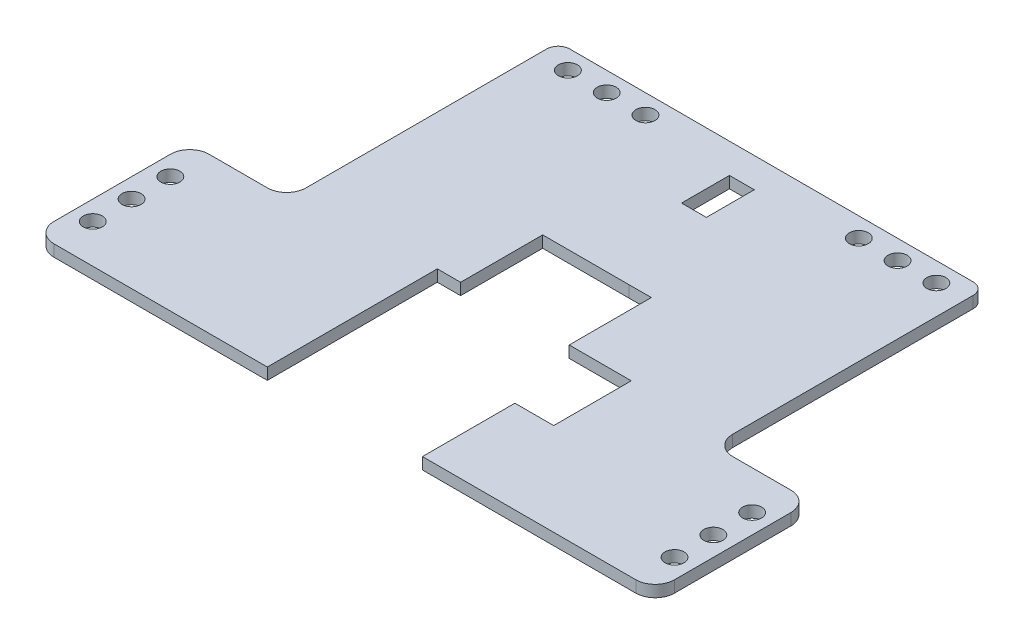
from build123d import *

# Parameters (mm, degrees)
SKETCH2_W           = 6.4
SKETCH2_H           = 12.35
SKETCH2_R           = 2.45
BOSS_EXTRUDE1_DEPTH = 3


with BuildPart() as part:
    # Sketch2 → Boss-Extrude1 (new body)
    with BuildSketch(Plane(origin=(0, 40, 0), x_dir=(1, 0, 0), z_dir=(0, 1, 0))):
        with BuildLine():
            Line((30, -16.164928148), (20, -16.164928148))
            Line((20, -16.164928148), (20, -40))
            Line((20, -40), (75, -40))
            ThreePointArc((75, -40), (78.535533906, -38.535533906), (80, -35))
            Line((80, -35), (80, -5))
            ThreePointArc((80, -5), (78.535533906, -1.464466094), (75, 0))
            Line((75, 0), (60, 0))
            ThreePointArc((60, 0), (56.464466094, 1.464466094), (55, 5))
            Line((55, 5), (55, 67))
            ThreePointArc((55, 67), (54.121320344, 69.121320344), (52, 70))
            Line((52, 70), (-52, 70))
            ThreePointArc((-52, 70), (-54.121320344, 69.121320344), (-55, 67))
            Line((-55, 67), (-55, 5))
            ThreePointArc((-55, 5), (-56.464466094, 1.464466094), (-60, 0))
            Line((-60, 0), (-75, 0))
            ThreePointArc((-75, 0), (-78.535533906, -1.464466094), (-80, -5))
            Line((-80, -5), (-80, -35))
            ThreePointArc((-80, -35), (-78.535533906, -38.535533906), (-75, -40))
            Line((-75, -40), (-20, -40))
            Line((-20, -40), (-20, 3.835071852))
            Line((-20, 3.835071852), (-14, 3.835071852))
            Line((-14, 3.835071852), (-14, 25))
            Line((-14, 25), (8.289849185, 25))
            Line((8.289849185, 25), (14, 25.022996562))
            Line((14, 25.022996562), (14, 3.835071852))
            Line((14, 3.835071852), (30, 3.835071852))
            Line((30, 3.835071852), (30, -16.164928148))
        make_face()
        with Locations((0, 56.175)):
            Rectangle(SKETCH2_W, SKETCH2_H, mode=Mode.SUBTRACT)
        with Locations(Location((-75, -30, 0), (0, 0, 270))):
            Circle(SKETCH2_R, mode=Mode.SUBTRACT)
        with Locations(Location((-75, -20, 0), (0, 0, 270))):
            Circle(SKETCH2_R, mode=Mode.SUBTRACT)
        with Locations(Location((-75, -10, 0), (0, 0, 270))):
            Circle(SKETCH2_R, mode=Mode.SUBTRACT)
        with Locations(Location((75, -30, 0), (0, 0, 270))):
            Circle(SKETCH2_R, mode=Mode.SUBTRACT)
        with Locations(Location((75, -20, 0), (0, 0, 270))):
            Circle(SKETCH2_R, mode=Mode.SUBTRACT)
        with Locations(Location((75, -10, 0), (0, 0, 270))):
            Circle(SKETCH2_R, mode=Mode.SUBTRACT)
        with Locations(Location((-47.5, 65, 0), (0, 0, 270))):
            Circle(SKETCH2_R, mode=Mode.SUBTRACT)
        with Locations(Location((-37.5, 65, 0), (0, 0, 270))):
            Circle(SKETCH2_R, mode=Mode.SUBTRACT)
        with Locations(Location((-27.5, 65, 0), (0, 0, 270))):
            Circle(SKETCH2_R, mode=Mode.SUBTRACT)
        with Locations(Location((27.5, 65, 0), (0, 0, 270))):
            Circle(SKETCH2_R, mode=Mode.SUBTRACT)
        with Locations(Location((37.5, 65, 0), (0, 0, 270))):
            Circle(SKETCH2_R, mode=Mode.SUBTRACT)
        with Locations(Location((47.5, 65, 0), (0, 0, 270))):
            Circle(SKETCH2_R, mode=Mode.SUBTRACT)
    extrude(amount=BOSS_EXTRUDE1_DEPTH)


solid = part.part
